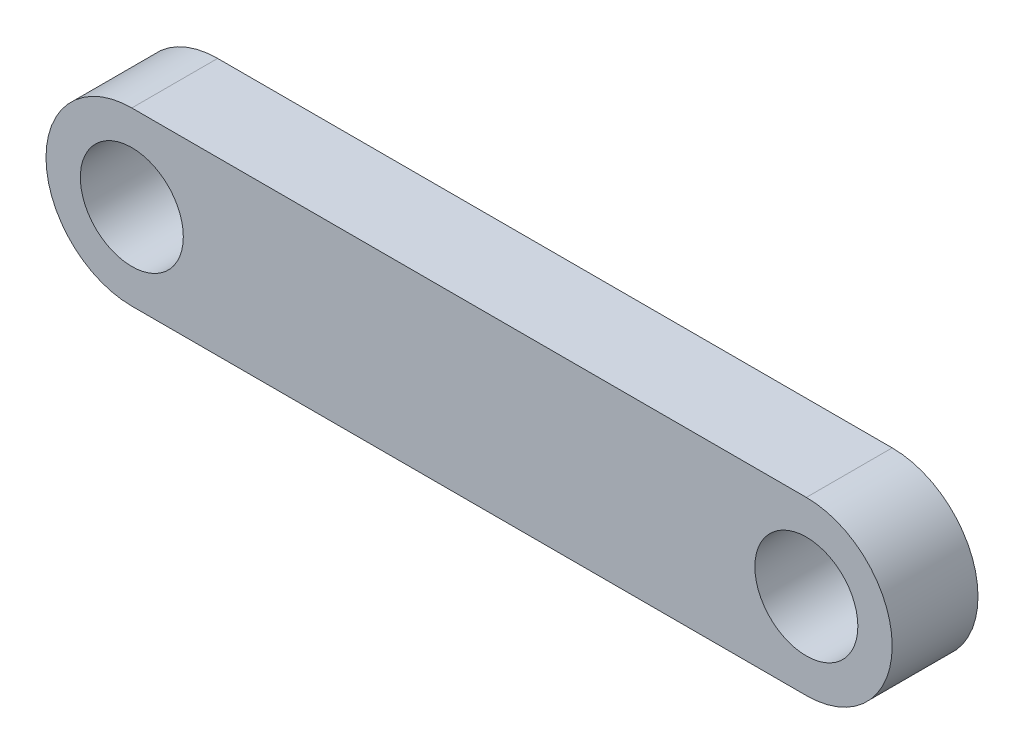
from build123d import *

# Parameters (mm, degrees)
SKETCH1_R           = 3
BOSS_EXTRUDE1_DEPTH = 5
SKETCH2_R           = 3
CUT_EXTRUDE2_DEPTH  = 15


with BuildPart() as part:
    # Sketch1 → Boss-Extrude1 (new body)
    with BuildSketch(Plane.XY):
        with BuildLine():
            Line((19.65, -5), (-19.65, -5))
            ThreePointArc((-19.65, -5), (-24.65, 0), (-19.65, 5))
            Line((-19.65, 5), (19.65, 5))
            ThreePointArc((19.65, 5), (24.65, 0), (19.65, -5))
        make_face()
        with Locations((-19.65, 0)):
            Circle(SKETCH1_R, mode=Mode.SUBTRACT)
    extrude(amount=BOSS_EXTRUDE1_DEPTH)

    # Sketch2 → Cut-Extrude2 (cut)
    with BuildSketch(Plane(origin=(0, 0, 0), x_dir=(-1, 0, 0), z_dir=(0, 0, -1))):
        with Locations((-19.65, 0)):
            Circle(SKETCH2_R)
    extrude(amount=-CUT_EXTRUDE2_DEPTH, mode=Mode.SUBTRACT)


solid = part.part
